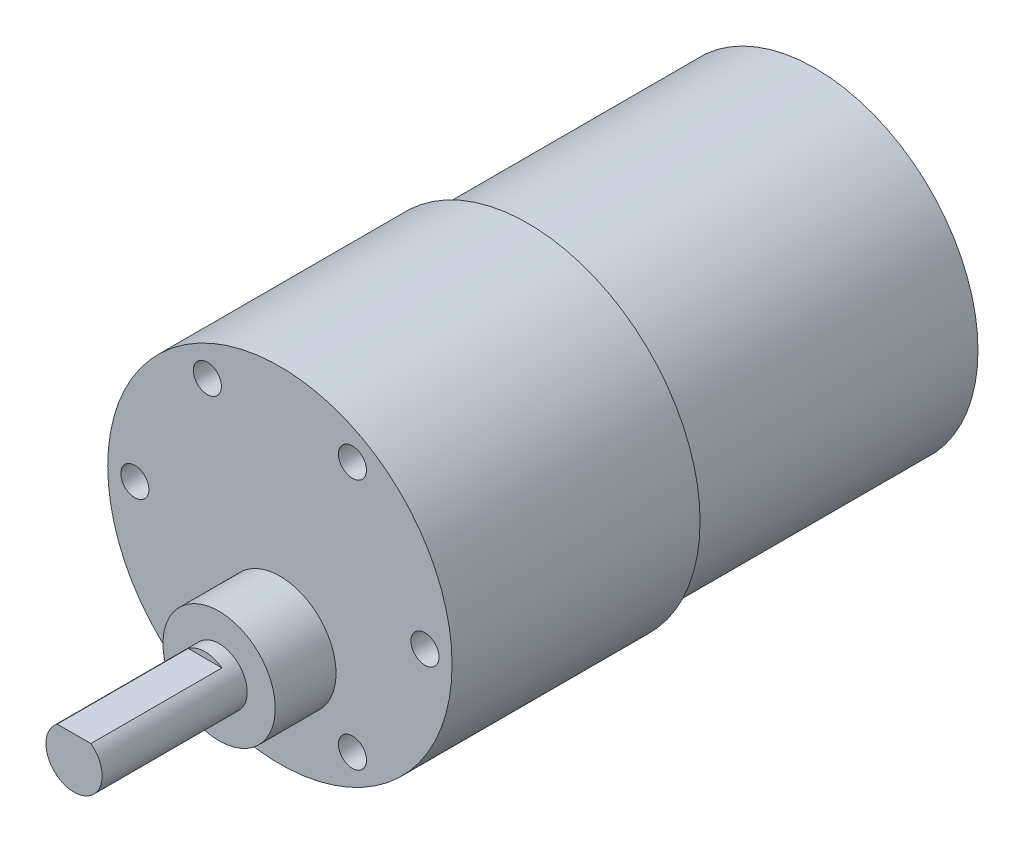
from build123d import *

# Parameters (mm, degrees)
SKETCH1_R           = 18.4
BOSS_EXTRUDE1_DEPTH = 26.5
SKETCH2_R           = 17.4
BOSS_EXTRUDE2_DEPTH = 30.7
SKETCH3_R           = 6
BOSS_EXTRUDE3_DEPTH = 6.5
SKETCH4_R           = 3
BOSS_EXTRUDE4_DEPTH = 15.5
CUT_EXTRUDE1_DEPTH  = 14
SKETCH6_R           = 1.5
CUT_EXTRUDE2_DEPTH  = 8


with BuildPart() as part:
    # Sketch1 → Boss-Extrude1 (new body)
    with BuildSketch(Plane.XY.offset(26.5)):
        Circle(SKETCH1_R)
    extrude(amount=-BOSS_EXTRUDE1_DEPTH)

    # Sketch2 → Boss-Extrude2 (add)
    with BuildSketch(Plane.XY):
        Circle(SKETCH2_R)
    extrude(amount=-BOSS_EXTRUDE2_DEPTH)

    # Sketch3 → Boss-Extrude3 (add)
    with BuildSketch(Plane.XY.offset(26.5)):
        with Locations(Location((0, -7, 0), (0, 0, 180))):
            Circle(SKETCH3_R)
    extrude(amount=BOSS_EXTRUDE3_DEPTH)

    # Sketch4 → Boss-Extrude4 (add)
    with BuildSketch(Plane.XY.offset(33)):
        with Locations((0, -7)):
            Circle(SKETCH4_R)
    extrude(amount=BOSS_EXTRUDE4_DEPTH)

    # Sketch5 → Cut-Extrude1 (cut)
    with BuildSketch(Plane.XY.offset(48.5)):
        Polygon((-4.411433232, -4.6), (4.412869288, -4.6), (0, -0.417886065), align=None)
    extrude(amount=-CUT_EXTRUDE1_DEPTH, mode=Mode.SUBTRACT)

    # Sketch6 → Cut-Extrude2 (cut)
    with BuildSketch(Plane.XY.offset(26.5)):
        with Locations((-15.5, 0)):
            Circle(SKETCH6_R)
        with Locations((-7.75, 13.423393759)):
            Circle(SKETCH6_R)
        with Locations((7.75, 13.423393759)):
            Circle(SKETCH6_R)
        with Locations((15.5, 0)):
            Circle(SKETCH6_R)
        with Locations((7.75, -13.423393759)):
            Circle(SKETCH6_R)
        with Locations((-7.75, -13.423393759)):
            Circle(SKETCH6_R)
    extrude(amount=-CUT_EXTRUDE2_DEPTH, mode=Mode.SUBTRACT)


solid = part.part
